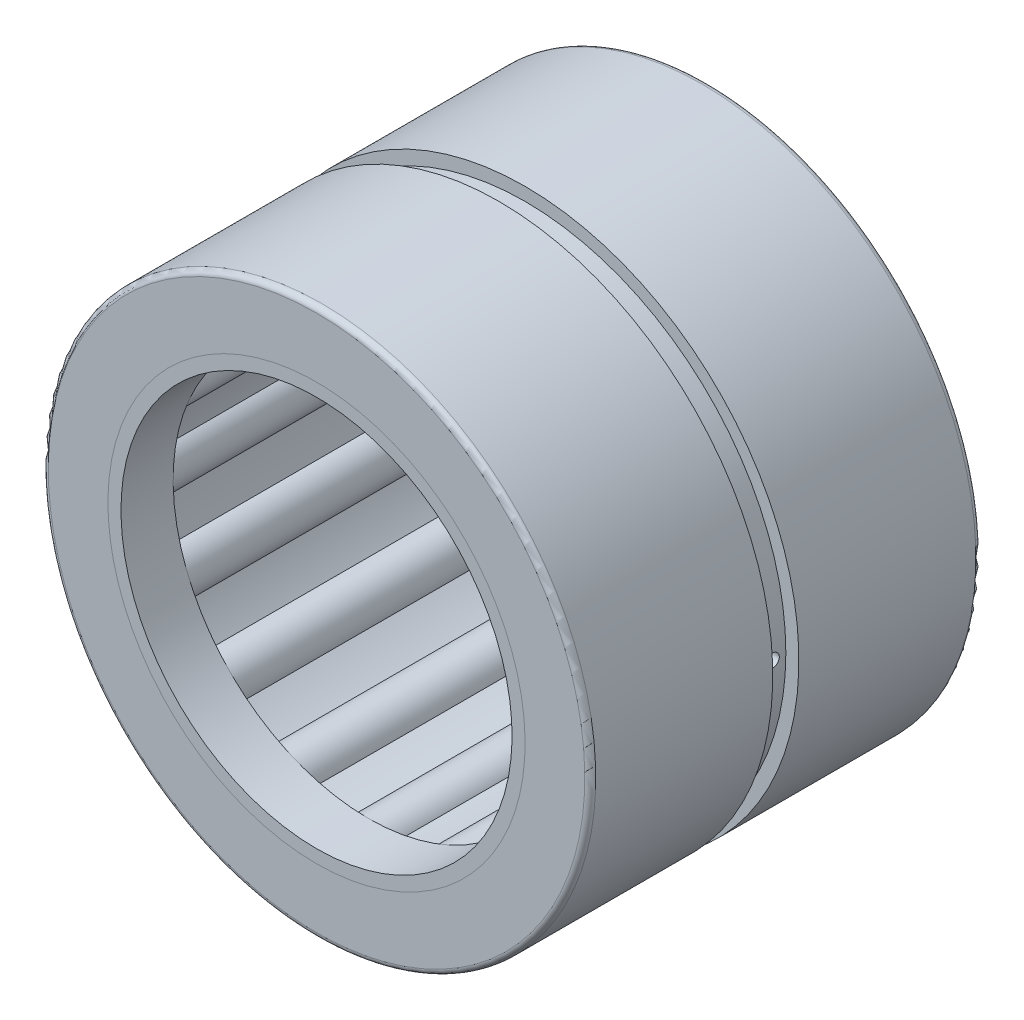
from build123d import *

# Parameters (mm, degrees)
SKETCH2_W           = 23.283333334
SKETCH2_H           = 1.5875
SKETCH3_W           = 27.516666666
SKETCH3_H           = 0.529166666
CIRPATTERN1_COUNT   = 16
CIRPATTERN1_ANGLE   = 337.5
FILLET1_R           = 0.4445
SKETCH5_W           = 4.233333333
SKETCH5_H           = 1.058333333
SKETCH7_R           = 20.362333333
SKETCH7_R_2         = 16.933333333
BOSS_EXTRUDE1_DEPTH = 25.4
SKETCH2_2_W         = 23.283333334
SKETCH2_2_H         = 1.5875
CIRPATTERN2_COUNT   = 16
SKETCH8_W           = 2.116666666
SKETCH8_H           = 1.058333333
SKETCH9_R           = 0.529166667
CUT_EXTRUDE1_DEPTH  = 36.212453516


with BuildPart() as part:
    # Sketch1 → Revolve1 (revolve)
    with BuildSketch(Plane(origin=(0, 0, 0), x_dir=(0, 0, -1), z_dir=(1, 0, 0)), mode=Mode.PRIVATE) as revolve1_sk:
        Polygon((-15.875, 22.225), (15.875, 22.225), (15.875, 16.933333333), (13.758333333, 16.933333333), (13.758333333, 20.108333333), (-13.758333333, 20.108333333), (-13.758333333, 16.933333333), (-15.875, 16.933333333), align=None)
    revolve(revolve1_sk.sketch.rotate(Axis((0, 0, 15.875), (0, 0, -1)), 180), axis=Axis((0, 0, 15.875), (0, 0, -1)))

    # Fillet1
    fillet1_edges = [part.edges().sort_by_distance(p)[0] for p in [
        (0, 22.225, 15.875),
        (0, 22.225, -15.875),
    ]]
    fillet(fillet1_edges, radius=FILLET1_R)

    # Sketch4 → Cut-Revolve1 (revolve, cut)
    with BuildSketch(Plane(origin=(0, 0, 0), x_dir=(0, 0, -1), z_dir=(1, 0, 0)), mode=Mode.PRIVATE) as cut_revolve1_sk:
        Polygon((-1.058333333, 22.225), (0, 21.166666667), (1.058333333, 22.225), align=None)
    revolve(cut_revolve1_sk.sketch.rotate(Axis((0, 0, 15.875), (0, 0, -1)), 180), axis=Axis((0, 0, 15.875), (0, 0, -1)), mode=Mode.SUBTRACT)

    # Sketch8 → Cut-Revolve3 (revolve, cut)
    with BuildSketch(Plane(origin=(0, 0, 0), x_dir=(0, 0, -1), z_dir=(1, 0, 0))):
        with Locations((0, 21.695833334)):
            Rectangle(SKETCH8_W, SKETCH8_H)
    revolve(axis=Axis((0, 0, 15.875), (0, 0, 1)), mode=Mode.SUBTRACT)

    # Sketch9 → Cut-Extrude1 (cut, through all)
    with BuildSketch(Plane(origin=(0, 0, 0), x_dir=(0, 0, -1), z_dir=(1, 0, 0))):
        with Locations(Location((0, 0, 0), (0, 0, 180))):
            Circle(SKETCH9_R)
    extrude(amount=CUT_EXTRUDE1_DEPTH, mode=Mode.SUBTRACT)


with BuildPart() as body_2:
    # Sketch2 → Revolve2 (revolve)
    with BuildSketch(Plane(origin=(0, 0, 0), x_dir=(0, 0, -1), z_dir=(1, 0, 0)), mode=Mode.PRIVATE) as revolve2_sk:
        with Locations((0, 19.314583333)):
            Rectangle(SKETCH2_W, SKETCH2_H)
    revolve(revolve2_sk.sketch.rotate(Axis((0, 17.991666667, 11.641666667), (0, 0, -1)), 180), axis=Axis((0, 17.991666667, 11.641666667), (0, 0, -1)))


with BuildPart() as body_3:
    # Sketch3 → Revolve3 (revolve)
    with BuildSketch(Plane(origin=(0, 0, 0), x_dir=(0, 0, -1), z_dir=(1, 0, 0)), mode=Mode.PRIVATE) as revolve3_sk:
        with Locations((0, 18.25625)):
            Rectangle(SKETCH3_W, SKETCH3_H)
    revolve(revolve3_sk.sketch.rotate(Axis((0, 17.991666667, 13.758333333), (0, 0, -1)), 90), axis=Axis((0, 17.991666667, 13.758333333), (0, 0, -1)))


with BuildPart() as cirpattern1_1:
    # CirPattern1: pattern copy
    add(body_3.part.rotate(Axis((0, 0, -15.875), (0, 0, 1)), 1 * CIRPATTERN1_ANGLE / (CIRPATTERN1_COUNT - 1)))


with BuildPart() as cirpattern1_2:
    # CirPattern1: pattern copy
    add(body_3.part.rotate(Axis((0, 0, -15.875), (0, 0, 1)), 2 * CIRPATTERN1_ANGLE / (CIRPATTERN1_COUNT - 1)))


with BuildPart() as cirpattern1_3:
    # CirPattern1: pattern copy
    add(body_3.part.rotate(Axis((0, 0, -15.875), (0, 0, 1)), 3 * CIRPATTERN1_ANGLE / (CIRPATTERN1_COUNT - 1)))


with BuildPart() as cirpattern1_4:
    # CirPattern1: pattern copy
    add(body_3.part.rotate(Axis((0, 0, -15.875), (0, 0, 1)), 4 * CIRPATTERN1_ANGLE / (CIRPATTERN1_COUNT - 1)))


with BuildPart() as cirpattern1_5:
    # CirPattern1: pattern copy
    add(body_3.part.rotate(Axis((0, 0, -15.875), (0, 0, 1)), 5 * CIRPATTERN1_ANGLE / (CIRPATTERN1_COUNT - 1)))


with BuildPart() as cirpattern1_6:
    # CirPattern1: pattern copy
    add(body_3.part.rotate(Axis((0, 0, -15.875), (0, 0, 1)), 6 * CIRPATTERN1_ANGLE / (CIRPATTERN1_COUNT - 1)))


with BuildPart() as cirpattern1_7:
    # CirPattern1: pattern copy
    add(body_3.part.rotate(Axis((0, 0, -15.875), (0, 0, 1)), 7 * CIRPATTERN1_ANGLE / (CIRPATTERN1_COUNT - 1)))


with BuildPart() as cirpattern1_8:
    # CirPattern1: pattern copy
    add(body_3.part.rotate(Axis((0, 0, -15.875), (0, 0, 1)), 8 * CIRPATTERN1_ANGLE / (CIRPATTERN1_COUNT - 1)))


with BuildPart() as cirpattern1_9:
    # CirPattern1: pattern copy
    add(body_3.part.rotate(Axis((0, 0, -15.875), (0, 0, 1)), 9 * CIRPATTERN1_ANGLE / (CIRPATTERN1_COUNT - 1)))


with BuildPart() as cirpattern1_10:
    # CirPattern1: pattern copy
    add(body_3.part.rotate(Axis((0, 0, -15.875), (0, 0, 1)), 10 * CIRPATTERN1_ANGLE / (CIRPATTERN1_COUNT - 1)))


with BuildPart() as cirpattern1_11:
    # CirPattern1: pattern copy
    add(body_3.part.rotate(Axis((0, 0, -15.875), (0, 0, 1)), 11 * CIRPATTERN1_ANGLE / (CIRPATTERN1_COUNT - 1)))


with BuildPart() as cirpattern1_12:
    # CirPattern1: pattern copy
    add(body_3.part.rotate(Axis((0, 0, -15.875), (0, 0, 1)), 12 * CIRPATTERN1_ANGLE / (CIRPATTERN1_COUNT - 1)))


with BuildPart() as cirpattern1_13:
    # CirPattern1: pattern copy
    add(body_3.part.rotate(Axis((0, 0, -15.875), (0, 0, 1)), 13 * CIRPATTERN1_ANGLE / (CIRPATTERN1_COUNT - 1)))


with BuildPart() as cirpattern1_14:
    # CirPattern1: pattern copy
    add(body_3.part.rotate(Axis((0, 0, -15.875), (0, 0, 1)), 14 * CIRPATTERN1_ANGLE / (CIRPATTERN1_COUNT - 1)))


with BuildPart() as cirpattern1_15:
    # CirPattern1: pattern copy
    add(body_3.part.rotate(Axis((0, 0, -15.875), (0, 0, 1)), 15 * CIRPATTERN1_ANGLE / (CIRPATTERN1_COUNT - 1)))


with BuildPart() as cirpattern1_16:
    # CirPattern1: pattern copy
    add(body_2.part.rotate(Axis((0, 0, -15.875), (0, 0, 1)), 1 * CIRPATTERN1_ANGLE / (CIRPATTERN1_COUNT - 1)))


with BuildPart() as cirpattern1_17:
    # CirPattern1: pattern copy
    add(body_2.part.rotate(Axis((0, 0, -15.875), (0, 0, 1)), 2 * CIRPATTERN1_ANGLE / (CIRPATTERN1_COUNT - 1)))


with BuildPart() as cirpattern1_18:
    # CirPattern1: pattern copy
    add(body_2.part.rotate(Axis((0, 0, -15.875), (0, 0, 1)), 3 * CIRPATTERN1_ANGLE / (CIRPATTERN1_COUNT - 1)))


with BuildPart() as cirpattern1_19:
    # CirPattern1: pattern copy
    add(body_2.part.rotate(Axis((0, 0, -15.875), (0, 0, 1)), 4 * CIRPATTERN1_ANGLE / (CIRPATTERN1_COUNT - 1)))


with BuildPart() as cirpattern1_20:
    # CirPattern1: pattern copy
    add(body_2.part.rotate(Axis((0, 0, -15.875), (0, 0, 1)), 5 * CIRPATTERN1_ANGLE / (CIRPATTERN1_COUNT - 1)))


with BuildPart() as cirpattern1_21:
    # CirPattern1: pattern copy
    add(body_2.part.rotate(Axis((0, 0, -15.875), (0, 0, 1)), 6 * CIRPATTERN1_ANGLE / (CIRPATTERN1_COUNT - 1)))


with BuildPart() as cirpattern1_22:
    # CirPattern1: pattern copy
    add(body_2.part.rotate(Axis((0, 0, -15.875), (0, 0, 1)), 7 * CIRPATTERN1_ANGLE / (CIRPATTERN1_COUNT - 1)))


with BuildPart() as cirpattern1_23:
    # CirPattern1: pattern copy
    add(body_2.part.rotate(Axis((0, 0, -15.875), (0, 0, 1)), 8 * CIRPATTERN1_ANGLE / (CIRPATTERN1_COUNT - 1)))


with BuildPart() as cirpattern1_24:
    # CirPattern1: pattern copy
    add(body_2.part.rotate(Axis((0, 0, -15.875), (0, 0, 1)), 9 * CIRPATTERN1_ANGLE / (CIRPATTERN1_COUNT - 1)))


with BuildPart() as cirpattern1_25:
    # CirPattern1: pattern copy
    add(body_2.part.rotate(Axis((0, 0, -15.875), (0, 0, 1)), 10 * CIRPATTERN1_ANGLE / (CIRPATTERN1_COUNT - 1)))


with BuildPart() as cirpattern1_26:
    # CirPattern1: pattern copy
    add(body_2.part.rotate(Axis((0, 0, -15.875), (0, 0, 1)), 11 * CIRPATTERN1_ANGLE / (CIRPATTERN1_COUNT - 1)))


with BuildPart() as cirpattern1_27:
    # CirPattern1: pattern copy
    add(body_2.part.rotate(Axis((0, 0, -15.875), (0, 0, 1)), 12 * CIRPATTERN1_ANGLE / (CIRPATTERN1_COUNT - 1)))


with BuildPart() as cirpattern1_28:
    # CirPattern1: pattern copy
    add(body_2.part.rotate(Axis((0, 0, -15.875), (0, 0, 1)), 13 * CIRPATTERN1_ANGLE / (CIRPATTERN1_COUNT - 1)))


with BuildPart() as cirpattern1_29:
    # CirPattern1: pattern copy
    add(body_2.part.rotate(Axis((0, 0, -15.875), (0, 0, 1)), 14 * CIRPATTERN1_ANGLE / (CIRPATTERN1_COUNT - 1)))


with BuildPart() as cirpattern1_30:
    # CirPattern1: pattern copy
    add(body_2.part.rotate(Axis((0, 0, -15.875), (0, 0, 1)), 15 * CIRPATTERN1_ANGLE / (CIRPATTERN1_COUNT - 1)))


with BuildPart() as body_34:
    # Sketch5 → Revolve4 (revolve)
    with BuildSketch(Plane(origin=(0, 0, 0), x_dir=(0, 0, -1), z_dir=(1, 0, 0)), mode=Mode.PRIVATE) as revolve4_sk:
        with Locations((13.758333334, 16.404166667)):
            Rectangle(SKETCH5_W, SKETCH5_H)
        with Locations((-13.758333334, 16.404166667)):
            Rectangle(SKETCH5_W, SKETCH5_H)
    revolve(revolve4_sk.sketch.rotate(Axis((0, 0, 15.875), (0, 0, -1)), 180), axis=Axis((0, 0, 15.875), (0, 0, -1)))


with BuildPart() as body_35:
    # Sketch7 → Boss-Extrude1 (new body)
    with BuildSketch(Plane.XY.offset(-11.641666667)):
        with Locations(Location((0, 0, 0), (0, 0, 270))):
            Circle(SKETCH7_R)
        with Locations(Location((0, 0, 0), (0, 0, 270))):
            Circle(SKETCH7_R_2, mode=Mode.SUBTRACT)
    extrude(amount=BOSS_EXTRUDE1_DEPTH)

    # Sketch2<2> → Cut-Revolve2 (revolve, cut)
    with BuildSketch(Plane(origin=(0, 0, 0), x_dir=(0, 0, -1), z_dir=(1, 0, 0))):
        with Locations((0, 19.314583333)):
            Rectangle(SKETCH2_2_W, SKETCH2_2_H)
    cut_revolve2 = revolve(axis=Axis((0, 17.991666667, 11.641666667), (0, 0, -1)), mode=Mode.SUBTRACT)

    # CirPattern2: Cut-Revolve2 ×16 about axis
    cirpattern2_axis = Axis((0, 0, 0), (0, 0, 1))
    for i in range(1, CIRPATTERN2_COUNT):
        add(cut_revolve2.rotate(cirpattern2_axis, i * 360 / CIRPATTERN2_COUNT), mode=Mode.SUBTRACT)


solid = Compound([part.part, body_2.part, body_3.part, cirpattern1_1.part, cirpattern1_2.part, cirpattern1_3.part, cirpattern1_4.part, cirpattern1_5.part, cirpattern1_6.part, cirpattern1_7.part, cirpattern1_8.part, cirpattern1_9.part, cirpattern1_10.part, cirpattern1_11.part, cirpattern1_12.part, cirpattern1_13.part, cirpattern1_14.part, cirpattern1_15.part, cirpattern1_16.part, cirpattern1_17.part, cirpattern1_18.part, cirpattern1_19.part, cirpattern1_20.part, cirpattern1_21.part, cirpattern1_22.part, cirpattern1_23.part, cirpattern1_24.part, cirpattern1_25.part, cirpattern1_26.part, cirpattern1_27.part, cirpattern1_28.part, cirpattern1_29.part, cirpattern1_30.part, body_34.part, body_35.part])
